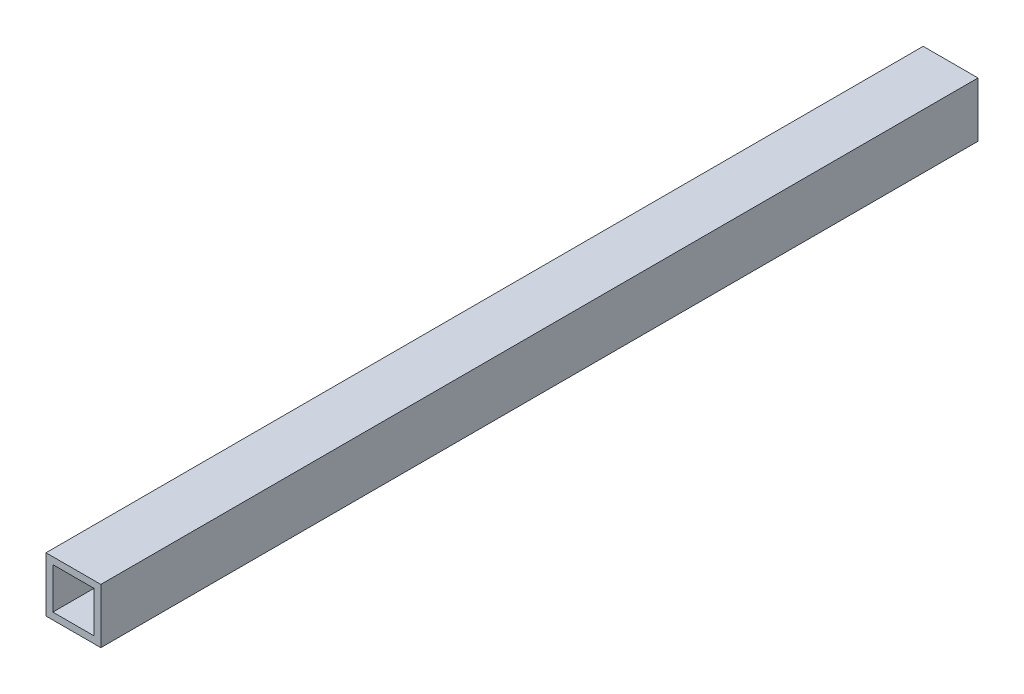
from build123d import *

# Parameters (mm, degrees)
SKETCH1_W           = 25.4
SKETCH1_H           = 25.4
SKETCH1_W_2         = 19.05
SKETCH1_H_2         = 19.05
BOSS_EXTRUDE1_DEPTH = 406.4


with BuildPart() as part:
    # Sketch1 → Boss-Extrude1 (new body)
    with BuildSketch(Plane.XY):
        Rectangle(SKETCH1_W, SKETCH1_H)
        Rectangle(SKETCH1_W_2, SKETCH1_H_2, mode=Mode.SUBTRACT)
    extrude(amount=BOSS_EXTRUDE1_DEPTH)


solid = part.part
